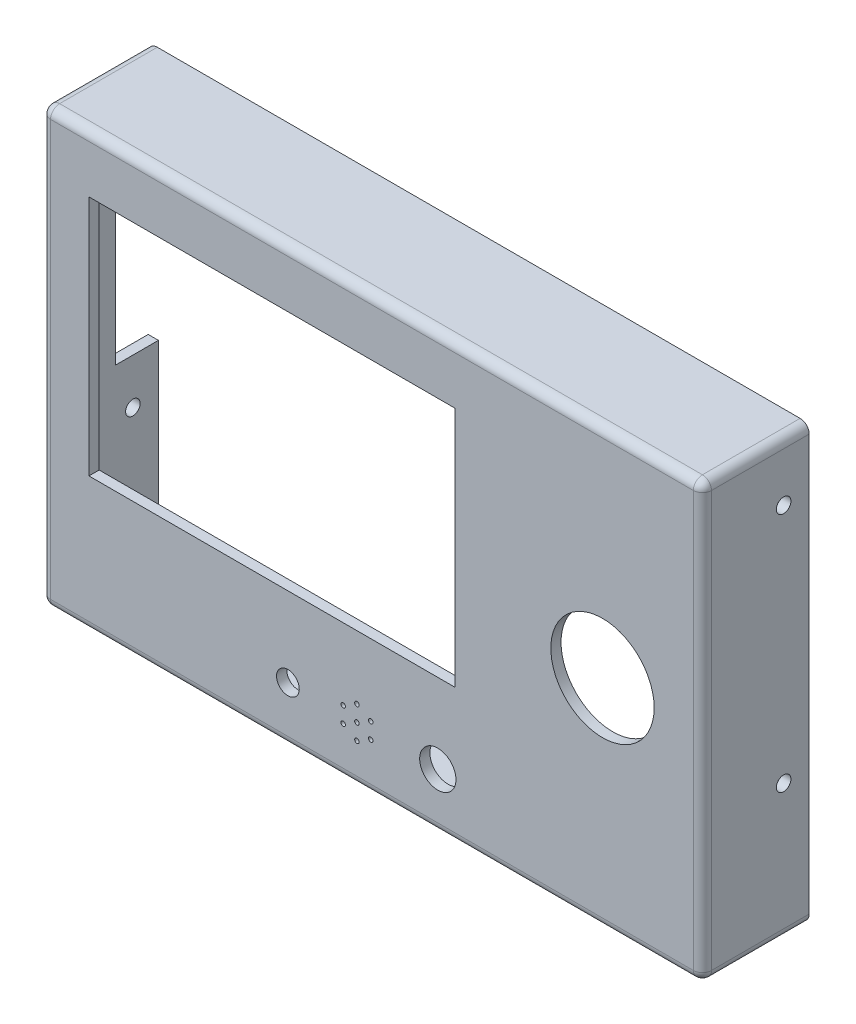
from build123d import *

# Parameters (mm, degrees)
FACE_SKETCH_W                       = 145.5
FACE_SKETCH_H                       = 95.5
FACE_SKETCH_R                       = 0.5
FACE_SKETCH_R_2                     = 2.5
FACE_SKETCH_R_3                     = 4
FACE_SKETCH_W_2                     = 80.6
FACE_SKETCH_H_2                     = 53.2
FACE_EXTRUDE_DEPTH                  = 2.25
SKETCH1_R                           = 11.375
STOP_BUTTON_MOUNTING_HOLE_CUT_DEPTH = 107.125809773
WALLS_SKETCH_W                      = 145.5
WALLS_SKETCH_H                      = 95.5
WALLS_SKETCH_W_2                    = 141
WALLS_SKETCH_H_2                    = 91
WALLS_EXTRUDE_DEPTH                 = 21.25
SD_CARD_ACCESS_SKETCH_W             = 9.5
SD_CARD_ACCESS_SKETCH_H             = 31
SD_CARD_CUT_DEPTH                   = 2.5
EDGE_RADIUS_R                       = 2
TOP_CONNECTORS_CUT_DEPTH            = 109.208999164
TOP_CONNECTORS_CUT_DEPTH_BACK       = 109.208999164
TOP_CONNECTORS_SKETCH_R             = 1.6


with BuildPart() as part:
    # Face Sketch → Face Extrude (new body)
    with BuildSketch(Plane.XY):
        with Locations((22, 0)):
            Rectangle(FACE_SKETCH_W, FACE_SKETCH_H)
        with Locations((18.7, -35.5)):
            Circle(FACE_SKETCH_R, mode=Mode.SUBTRACT)
        with Locations((3.5, -35.5)):
            Circle(FACE_SKETCH_R_2, mode=Mode.SUBTRACT)
        with Locations((36.5, -35.5)):
            Circle(FACE_SKETCH_R_3, mode=Mode.SUBTRACT)
        with Locations((18.7, -32)):
            Circle(FACE_SKETCH_R, mode=Mode.SUBTRACT)
        with Locations((21.731088913, -33.75)):
            Circle(FACE_SKETCH_R, mode=Mode.SUBTRACT)
        with Locations((21.731088913, -37.25)):
            Circle(FACE_SKETCH_R, mode=Mode.SUBTRACT)
        with Locations((18.7, -39)):
            Circle(FACE_SKETCH_R, mode=Mode.SUBTRACT)
        with Locations((15.668911087, -37.25)):
            Circle(FACE_SKETCH_R, mode=Mode.SUBTRACT)
        with Locations((15.668911087, -33.75)):
            Circle(FACE_SKETCH_R, mode=Mode.SUBTRACT)
        with Locations((0, 8.6)):
            Rectangle(FACE_SKETCH_W_2, FACE_SKETCH_H_2, mode=Mode.SUBTRACT)
    extrude(amount=FACE_EXTRUDE_DEPTH)

    # Sketch1 → Stop Button Mounting Hole Cut (cut, through all)
    with BuildSketch(Plane.XY):
        with Locations((72.75, 0)):
            Circle(SKETCH1_R)
    extrude(amount=STOP_BUTTON_MOUNTING_HOLE_CUT_DEPTH, mode=Mode.SUBTRACT)

    # Walls Sketch → Walls Extrude (add)
    with BuildSketch(Plane(origin=(0, 0, 0), x_dir=(-1, 0, 0), z_dir=(0, 0, -1))):
        with Locations((-22, 0)):
            Rectangle(WALLS_SKETCH_W, WALLS_SKETCH_H)
        with Locations((-22, 0)):
            Rectangle(WALLS_SKETCH_W_2, WALLS_SKETCH_H_2, mode=Mode.SUBTRACT)
    extrude(amount=WALLS_EXTRUDE_DEPTH)

    # SD Card Access Sketch → SD Card Cut (cut)
    with BuildSketch(Plane.ZY.offset(50.75)):
        with Locations((-16.5, 7.5)):
            Rectangle(SD_CARD_ACCESS_SKETCH_W, SD_CARD_ACCESS_SKETCH_H)
    extrude(amount=-SD_CARD_CUT_DEPTH, mode=Mode.SUBTRACT)

    # Edge Radius
    edge_radius_edges = [part.edges().sort_by_distance(p)[0] for p in [
        (94.75, 0, 2.25),
        (22, 47.75, 2.25),
        (-50.75, 0, 2.25),
        (22, -47.75, 2.25),
        (-50.75, 47.75, -9.5),
        (94.75, 47.75, -9.5),
        (94.75, -47.75, -9.5),
        (-50.75, -47.75, -9.5),
    ]]
    fillet(edge_radius_edges, radius=EDGE_RADIUS_R)

    # Top Connectors Sketch → Top Connectors Cut (cut, two sides: drawn at the far end of the back side and taken through both)
    with BuildSketch(Plane(origin=(0, 0, 0), x_dir=(0, 0, -1), z_dir=(1, 0, 0)).offset(-TOP_CONNECTORS_CUT_DEPTH_BACK)):
        with Locations((15.625, 35)):
            Circle(TOP_CONNECTORS_SKETCH_R)
        with Locations((15.625, -18)):
            Circle(TOP_CONNECTORS_SKETCH_R)
    extrude(amount=TOP_CONNECTORS_CUT_DEPTH + TOP_CONNECTORS_CUT_DEPTH_BACK, mode=Mode.SUBTRACT)


solid = part.part
